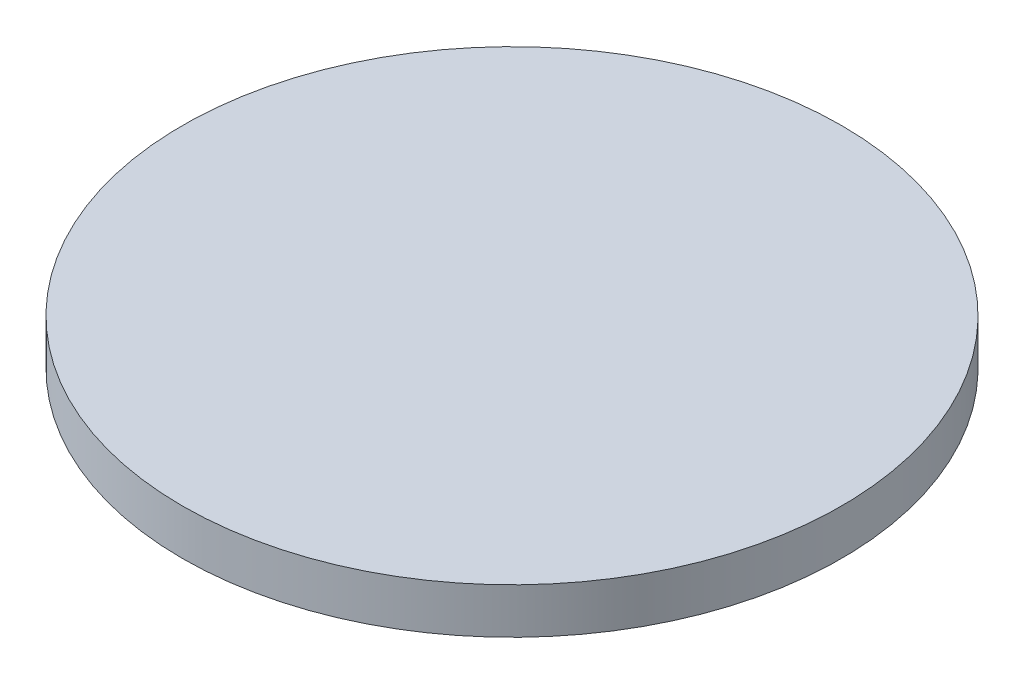
from build123d import *

# Parameters (mm, degrees)
SKETCH1_R           = 11.5
BOSS_EXTRUDE1_DEPTH = 1.5875


with BuildPart() as part:
    # Sketch1 → Boss-Extrude1 (new body)
    with BuildSketch(Plane(origin=(0, 0, 0), x_dir=(1, 0, 0), z_dir=(0, 1, 0))):
        with Locations(Location((0, 0, 0), (0, 0, 270))):
            Circle(SKETCH1_R)
    extrude(amount=BOSS_EXTRUDE1_DEPTH)


solid = part.part
